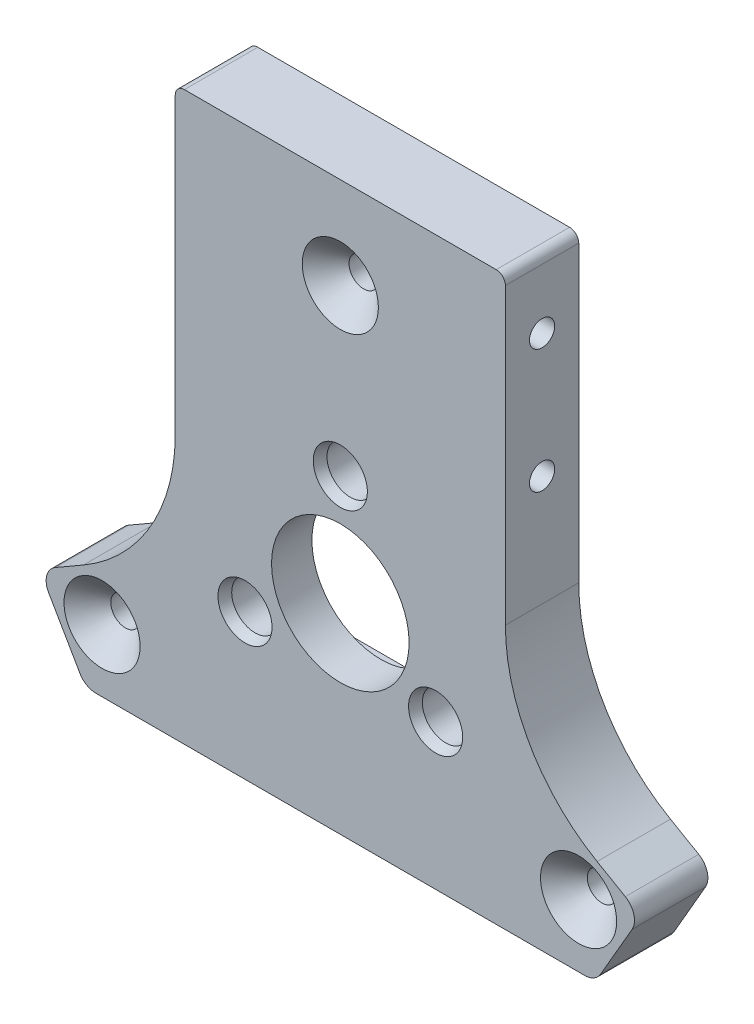
from build123d import *

# Parameters (mm, degrees)
SKETCH2_R                                       = 7.5
BOSS_EXTRUDE1_DEPTH                             = 8
CSK_FOR_M3_FLAT_HEAD_MACHINE_SCREW2_D           = 3.2
CSK_FOR_M3_FLAT_HEAD_MACHINE_SCREW2_CSINK_D     = 8.3
CSK_FOR_M3_FLAT_HEAD_MACHINE_SCREW2_CSINK_ANGLE = 90
FILLET1_R                                       = 20
V_GROOVE_CUTOUT_FLIPPED_DEPTH                   = 3.6
SKETCH49_R                                      = 2.55
CUT_EXTRUDE3_DEPTH                              = 52.922196079
CHAMFER2_SIZE                                   = 0.4
CHAMFER2_SIZE2                                  = 1.098990968
MOVE_FACE2_BY                                   = 0.5
MOVE_FACE2_2_BY                                 = 0.5
MOVE_FACE2_3_BY                                 = 0.5
MOVE_FACE2_4_BY                                 = 0.5
MOVE_FACE2_5_BY                                 = 0.5
MOVE_FACE2_6_BY                                 = 0.5
CIRPATTERN2_COUNT                               = 3
SKETCH20_R                                      = 1.375
TOOL_WING_SCREW_HOLES_DEPTH                     = 4
FILLET17_R                                      = 2
FILLET18_R                                      = 1
SKETCH50_R                                      = 1.375
CUT_EXTRUDE4_DEPTH                              = 4


with BuildPart() as part:
    # Sketch2 → Boss-Extrude1 (new body)
    with BuildSketch(Plane.XY):
        Polygon((-18, 40), (18, 40), (18, -4.618802154), (32.810889132, -13.169872981), (27.810889132, -21.830127019), (-27.810889132, -21.830127019), (-32.810889132, -13.169872981), (-18, -4.618802154), align=None)
        Circle(SKETCH2_R, mode=Mode.SUBTRACT)
    extrude(amount=BOSS_EXTRUDE1_DEPTH)

    # CSK for M3 Flat Head Machine Screw2 (through all)
    with Locations(Plane.XY.offset(8)):
        with Locations((-25.980762114, -15), (0, 30), (25.980762114, -15)):
            CounterSinkHole(CSK_FOR_M3_FLAT_HEAD_MACHINE_SCREW2_D / 2, CSK_FOR_M3_FLAT_HEAD_MACHINE_SCREW2_CSINK_D / 2, counter_sink_angle=CSK_FOR_M3_FLAT_HEAD_MACHINE_SCREW2_CSINK_ANGLE)

    # Fillet1
    fillet1_edges = [part.edges().sort_by_distance(p)[0] for p in [
        (18, -4.618802154, 4),
        (-18, -4.618802154, 4),
    ]]
    fillet(fillet1_edges, radius=FILLET1_R)

    # Sketch47 → v-groove cutout flipped (cut)
    with BuildSketch(Plane(origin=(0, 0, 0), x_dir=(-1, 0, 0), z_dir=(0, 0, -1))):
        with BuildLine():
            Line((-3.464101615, 14), (-13.856406461, -4))
            ThreePointArc((-13.856406461, -4), (-13.856406461, -8), (-10.392304845, -10))
            Line((-10.392304845, -10), (10.392304845, -10))
            ThreePointArc((10.392304845, -10), (13.856406461, -8), (13.856406461, -4))
            Line((13.856406461, -4), (3.464101615, 14))
            ThreePointArc((3.464101615, 14), (0, 16), (-3.464101615, 14))
        make_face()
    extrude(amount=-V_GROOVE_CUTOUT_FLIPPED_DEPTH, mode=Mode.SUBTRACT)

    # Sketch49 → Cut-Extrude3 (cut, through all)
    with BuildSketch(Plane(origin=(0, 0, 3.6), x_dir=(-1, 0, 0), z_dir=(0, 0, -1))):
        with Locations((0, 12)):
            Circle(SKETCH49_R)
        with Locations((10.392304845, -6)):
            Circle(SKETCH49_R)
        with Locations((-10.392304845, -6)):
            Circle(SKETCH49_R)
    extrude(amount=-CUT_EXTRUDE3_DEPTH, mode=Mode.SUBTRACT)

    # Chamfer2
    chamfer2_edges = [part.edges().sort_by_distance(p)[0] for p in [
        (2.55, 12, 8),
        (-7.842304845, -6, 8),
        (12.942304845, -6, 8),
    ]]
    chamfer2_side = [part.faces().sort_by_distance(p)[0] for p in [
        (17.098380214, 23.464101615, 8),
    ]]
    chamfer(chamfer2_edges, length=CHAMFER2_SIZE, length2=CHAMFER2_SIZE2, reference=chamfer2_side[0])

    # Move Face2: a curved face moved inward by 0.5
    add(Solid.thicken(part.faces().sort_by_distance((-13.856406461, -8, 1.8))[0], -MOVE_FACE2_BY), mode=Mode.SUBTRACT)

    # Move Face2 2: a face moved inward by 0.5
    extrude(part.faces().sort_by_distance((0, -10, 1.8))[0], amount=MOVE_FACE2_2_BY, dir=(0, -1, 0), mode=Mode.SUBTRACT)

    # Move Face2 3: a curved face moved inward by 0.5
    add(Solid.thicken(part.faces().sort_by_distance((13.856406461, -8, 1.8))[0], -MOVE_FACE2_3_BY), mode=Mode.SUBTRACT)

    # Move Face2 4: a face moved inward by 0.5
    extrude(part.faces().sort_by_distance((8.660254038, 5, 1.8))[0], amount=MOVE_FACE2_4_BY, dir=(0.866025404, 0.5, 0), mode=Mode.SUBTRACT)

    # Move Face2 5: a curved face moved inward by 0.5
    add(Solid.thicken(part.faces().sort_by_distance((0, 16, 1.8))[0], -MOVE_FACE2_5_BY), mode=Mode.SUBTRACT)

    # Move Face2 6: a face moved inward by 0.5
    extrude(part.faces().sort_by_distance((-8.660254038, 5, 1.8))[0], amount=MOVE_FACE2_6_BY, dir=(-0.866025404, 0.5, 0), mode=Mode.SUBTRACT)

    # Sketch46 → tool ball cutout (revolve, cut)
    with BuildSketch(Plane(origin=(0, 30, 0), x_dir=(1, 0, 0), z_dir=(0, 1, 0))):
        with BuildLine():
            Line((0, 4.3), (0, -3.7))
            ThreePointArc((0, -3.7), (-4, 0.3), (0, 4.3))
        make_face()
    tool_ball_cutout = revolve(axis=Axis((0, 30, 0), (0, 0, -1)), mode=Mode.SUBTRACT)

    # CirPattern2: tool ball cutout ×3 about axis
    cirpattern2_axis = Axis((0, 0, 0), (0, 0, 1))
    for i in range(1, CIRPATTERN2_COUNT):
        add(tool_ball_cutout.rotate(cirpattern2_axis, i * 360 / CIRPATTERN2_COUNT), mode=Mode.SUBTRACT)

    # Sketch20 → Tool Wing Screw Holes (cut)
    with BuildSketch(Plane(origin=(18, 0, 0), x_dir=(0, 0, -1), z_dir=(1, 0, 0))):
        with Locations(Location((-4, 19, 0), (0, 0, 90))):
            Circle(SKETCH20_R)
        with Locations(Location((-4, 32.5, 0), (0, 0, 90))):
            Circle(SKETCH20_R)
    tool_wing_screw_holes = extrude(amount=-TOOL_WING_SCREW_HOLES_DEPTH, mode=Mode.SUBTRACT)

    # Mirror2: Tool Wing Screw Holes across plane
    add(tool_wing_screw_holes.mirror(Plane(origin=(0, 0, 0), x_dir=(0, 0, 1), z_dir=(1, 0, 0))), mode=Mode.SUBTRACT)

    # Fillet17
    fillet17_edges = [part.edges().sort_by_distance(p)[0] for p in [
        (32.810889132, -13.169872981, 4),
        (27.810889132, -21.830127019, 4),
        (-27.810889132, -21.830127019, 4),
        (-32.810889132, -13.169872981, 4),
    ]]
    fillet(fillet17_edges, radius=FILLET17_R)

    # Fillet18
    fillet18_edges = [part.edges().sort_by_distance(p)[0] for p in [
        (-18, 40, 4),
        (18, 40, 4),
    ]]
    fillet(fillet18_edges, radius=FILLET18_R)

    # Sketch50 → Cut-Extrude4 (cut)
    with BuildSketch(Plane.XZ.offset(21.830127019)):
        with Locations((-15, 4)):
            Circle(SKETCH50_R)
        with Locations((15, 4)):
            Circle(SKETCH50_R)
    extrude(amount=-CUT_EXTRUDE4_DEPTH, mode=Mode.SUBTRACT)


solid = part.part
